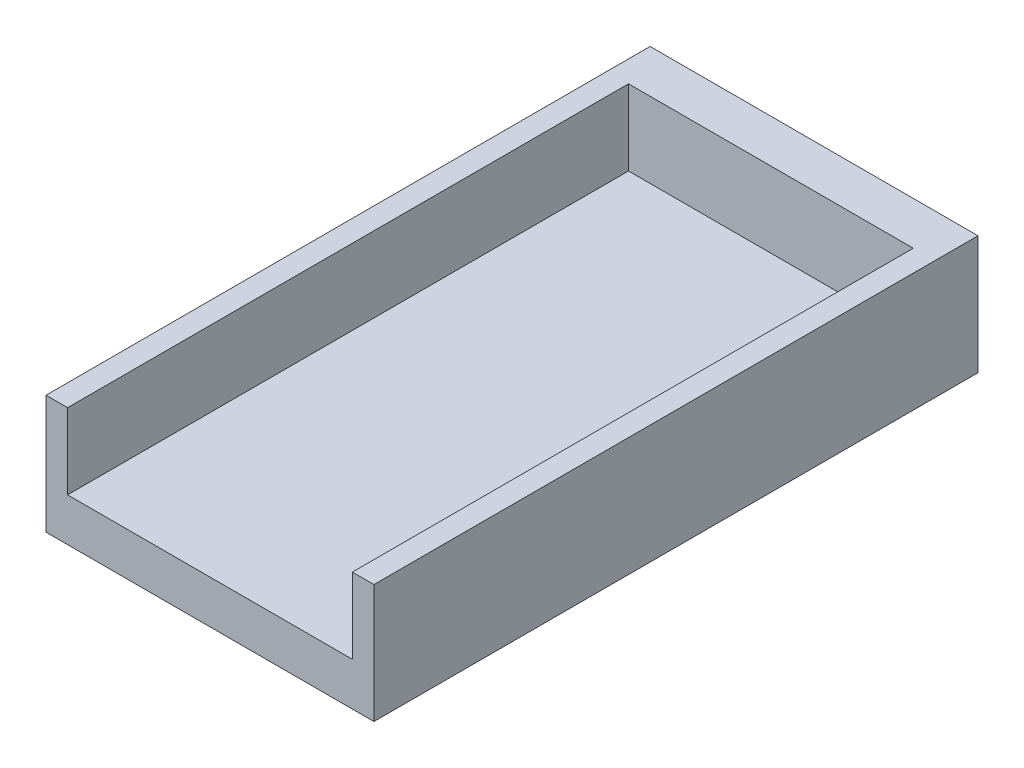
from build123d import *

# Parameters (mm, degrees)
SKETCH1_W               = 15.2
SKETCH1_H               = 28
BOSS_EXTRUDE1_DEPTH     = 5.5
CUT_EXTRUDE1_DEPTH      = 14
CUT_EXTRUDE1_DEPTH_BACK = 12
SKETCH2_W               = 13.2
SKETCH2_H               = 5.5


with BuildPart() as part:
    # Sketch1 → Boss-Extrude1 (new body)
    with BuildSketch(Plane(origin=(0, 0, 0), x_dir=(1, 0, 0), z_dir=(0, 1, 0))):
        Rectangle(SKETCH1_W, SKETCH1_H)
    extrude(amount=BOSS_EXTRUDE1_DEPTH)

    # Sketch2 → Cut-Extrude1 (cut, two sides: drawn at the far end of the back side and taken through both)
    with BuildSketch(Plane.XY.offset(-CUT_EXTRUDE1_DEPTH_BACK)):
        with Locations((0, 4.75)):
            Rectangle(SKETCH2_W, SKETCH2_H)
    extrude(amount=CUT_EXTRUDE1_DEPTH + CUT_EXTRUDE1_DEPTH_BACK, mode=Mode.SUBTRACT)


solid = part.part
